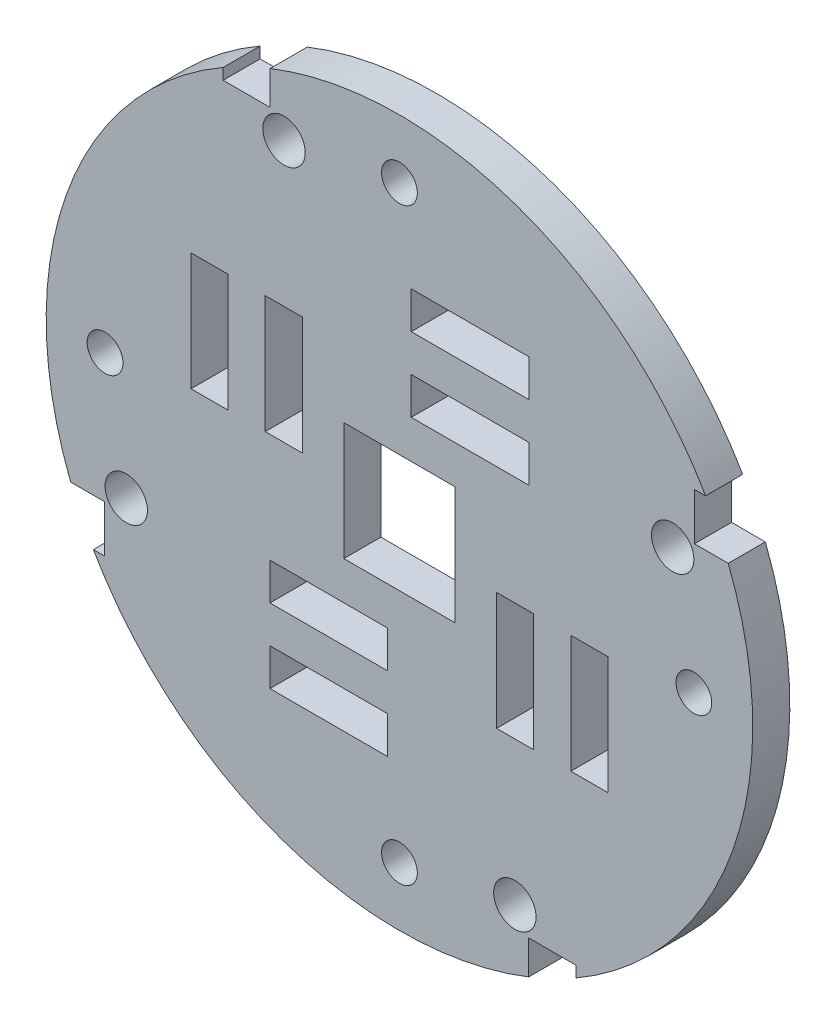
from build123d import *

# Parameters (mm, degrees)
SKETCH1_R           = 38.1
BOSS_EXTRUDE1_DEPTH = 4
SKETCH2_R           = 2.286
SKETCH2_W           = 12.7
SKETCH2_H           = 4
SKETCH2_W_2         = 4
SKETCH2_H_2         = 12.7
CUT_EXTRUDE1_DEPTH  = 55.029806589
CUT_EXTRUDE2_REACH  = 56.03
SKETCH3_W           = 12
SKETCH3_H           = 12.7
SKETCH4_R           = 1.9304
CUT_EXTRUDE3_DEPTH  = 55.029806589
CUT_EXTRUDE4_REACH  = 56.03
SKETCH5_W           = 5.08
SKETCH5_H           = 5.08


with BuildPart() as part:
    # Sketch1 → Boss-Extrude1 (new body)
    with BuildSketch(Plane.XY):
        Circle(SKETCH1_R)
    extrude(amount=BOSS_EXTRUDE1_DEPTH)

    # Sketch2 → Cut-Extrude1 (cut, through all)
    with BuildSketch(Plane.XY.offset(4)):
        with Locations((12.446, -29.464)):
            Circle(SKETCH2_R)
        with Locations((-29.464, -12.446)):
            Circle(SKETCH2_R)
        with Locations((-12.446, 29.464)):
            Circle(SKETCH2_R)
        with Locations((29.464, 12.446)):
            Circle(SKETCH2_R)
        with Locations((-7.62, -12.478)):
            Rectangle(SKETCH2_W, SKETCH2_H)
        with Locations((12.478, -7.62)):
            Rectangle(SKETCH2_W_2, SKETCH2_H_2)
        with Locations((20.478, -7.62)):
            Rectangle(SKETCH2_W_2, SKETCH2_H_2)
        with Locations((-7.62, -20.478)):
            Rectangle(SKETCH2_W, SKETCH2_H)
        with Locations((-12.478, 7.62)):
            Rectangle(SKETCH2_W_2, SKETCH2_H_2)
        with Locations((-20.478, 7.62)):
            Rectangle(SKETCH2_W_2, SKETCH2_H_2)
        with Locations((7.62, 12.478)):
            Rectangle(SKETCH2_W, SKETCH2_H)
        with Locations((7.62, 20.478)):
            Rectangle(SKETCH2_W, SKETCH2_H)
    extrude(amount=-CUT_EXTRUDE1_DEPTH, mode=Mode.SUBTRACT)

    # Sketch3 → Cut-Extrude2 (cut, up to next)
    with BuildSketch(Plane.XY.offset(4), mode=Mode.PRIVATE) as cut_extrude2_sk1:
        Rectangle(SKETCH3_W, SKETCH3_H)
    cut_extrude2_tool1 = extrude(cut_extrude2_sk1.sketch, amount=-CUT_EXTRUDE2_REACH, mode=Mode.PRIVATE) & part.part
    add(cut_extrude2_tool1.solids().sort_by_distance((0, 0, 4))[0], mode=Mode.SUBTRACT)

    # Sketch4 → Cut-Extrude3 (cut, through all)
    with BuildSketch(Plane.XY.offset(4)):
        with Locations((0, -31.75)):
            Circle(SKETCH4_R)
        with Locations((31.75, 0)):
            Circle(SKETCH4_R)
        with Locations((0, 31.75)):
            Circle(SKETCH4_R)
        with Locations((-31.75, 0)):
            Circle(SKETCH4_R)
    extrude(amount=-CUT_EXTRUDE3_DEPTH, mode=Mode.SUBTRACT)

    # Sketch5 → Cut-Extrude4 (cut, up to next)
    with BuildSketch(Plane.XY.offset(4), mode=Mode.PRIVATE) as cut_extrude4_sk1:
        with Locations((34.352372786, 16.478)):
            Rectangle(SKETCH5_W, SKETCH5_H)
    cut_extrude4_tool1 = extrude(cut_extrude4_sk1.sketch, amount=-CUT_EXTRUDE4_REACH, mode=Mode.PRIVATE) & part.part
    # Sketch5 → Cut-Extrude4 (cut, up to next)
    with BuildSketch(Plane.XY.offset(4), mode=Mode.PRIVATE) as cut_extrude4_sk2:
        with Locations((16.478, -34.352372786)):
            Rectangle(SKETCH5_W, SKETCH5_H)
    cut_extrude4_tool2 = extrude(cut_extrude4_sk2.sketch, amount=-CUT_EXTRUDE4_REACH, mode=Mode.PRIVATE) & part.part
    # Sketch5 → Cut-Extrude4 (cut, up to next)
    with BuildSketch(Plane.XY.offset(4), mode=Mode.PRIVATE) as cut_extrude4_sk3:
        with Locations((-34.352372786, -16.478)):
            Rectangle(SKETCH5_W, SKETCH5_H)
    cut_extrude4_tool3 = extrude(cut_extrude4_sk3.sketch, amount=-CUT_EXTRUDE4_REACH, mode=Mode.PRIVATE) & part.part
    # Sketch5 → Cut-Extrude4 (cut, up to next)
    with BuildSketch(Plane.XY.offset(4), mode=Mode.PRIVATE) as cut_extrude4_sk4:
        with Locations((-16.478, 34.352372786)):
            Rectangle(SKETCH5_W, SKETCH5_H)
    cut_extrude4_tool4 = extrude(cut_extrude4_sk4.sketch, amount=-CUT_EXTRUDE4_REACH, mode=Mode.PRIVATE) & part.part
    add(cut_extrude4_tool1.solids().sort_by_distance((34.352373, 16.478, 4))[0], mode=Mode.SUBTRACT)
    add(cut_extrude4_tool2.solids().sort_by_distance((16.478, -34.352373, 4))[0], mode=Mode.SUBTRACT)
    add(cut_extrude4_tool3.solids().sort_by_distance((-34.352373, -16.478, 4))[0], mode=Mode.SUBTRACT)
    add(cut_extrude4_tool4.solids().sort_by_distance((-16.478, 34.352373, 4))[0], mode=Mode.SUBTRACT)


solid = part.part
